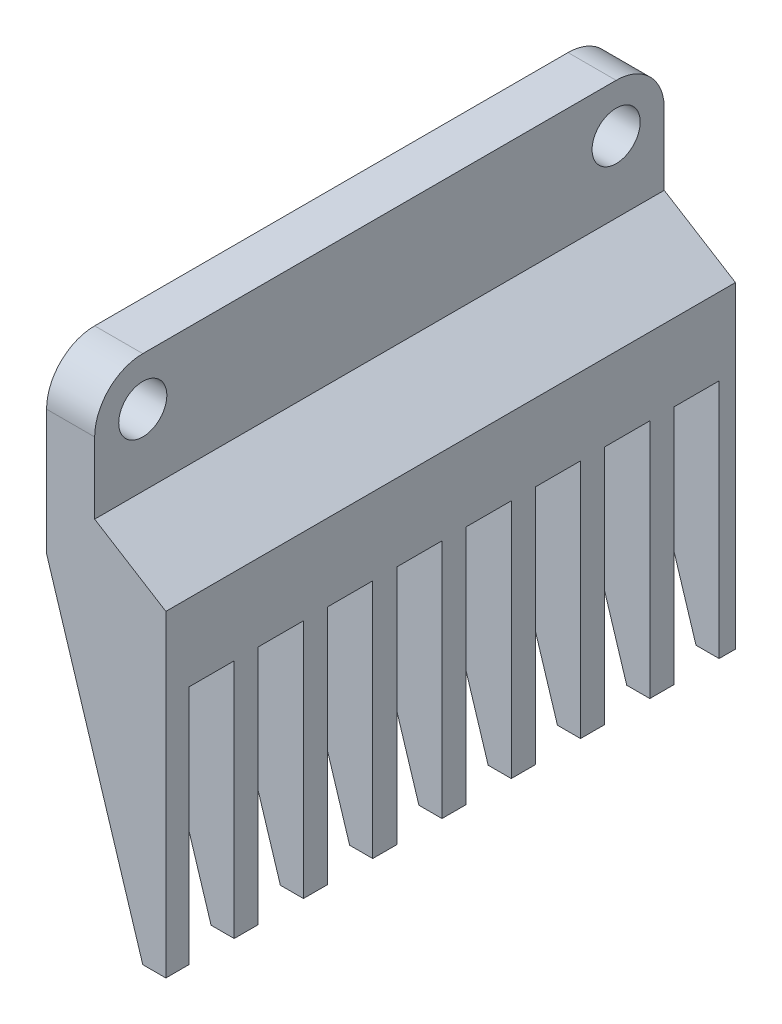
from build123d import *

# Parameters (mm, degrees)
BOSS_EXTRUDE1_DEPTH = 75.184
FILLET1_R           = 6.35
SKETCH6_R           = 3.175
CUT_EXTRUDE2_DEPTH  = 62.992
SKETCH11_W          = 5.969
SKETCH11_H          = 31.75
CUT_EXTRUDE6_DEPTH  = 100.663851822


with BuildPart() as part:
    # Sketch1 → Boss-Extrude1 (new body)
    with BuildSketch(Plane.XY):
        Polygon((0, 0), (3.048, 0), (3.048, 41.91), (-6.35, 47.752), (-6.35, 63.5), (-12.7, 63.5), (-12.7, 40.64), align=None)
    extrude(amount=BOSS_EXTRUDE1_DEPTH)

    # Fillet1
    fillet1_edges = [part.edges().sort_by_distance(p)[0] for p in [
        (-9.525, 63.5, 75.184),
        (-9.525, 63.5, 0),
    ]]
    fillet(fillet1_edges, radius=FILLET1_R)

    # Sketch6 → Cut-Extrude2 (cut, symmetric)
    with BuildSketch(Plane(origin=(-6.35, 0, 0), x_dir=(0, 0, -1), z_dir=(1, 0, 0))):
        with Locations(Location((-68.834, 57.15, 0), (0, 0, 90))):
            Circle(SKETCH6_R)
        with Locations(Location((-6.35, 57.15, 0), (0, 0, 90))):
            Circle(SKETCH6_R)
    extrude(amount=CUT_EXTRUDE2_DEPTH, both=True, mode=Mode.SUBTRACT)

    # Sketch11 → Cut-Extrude6 (cut, through all)
    with BuildSketch(Plane(origin=(3.048, 0, 0), x_dir=(0, 0, -1), z_dir=(1, 0, 0))):
        with Locations((-69.1515, 15.875)):
            Rectangle(SKETCH11_W, SKETCH11_H)
        with Locations((-60.0075, 15.875)):
            Rectangle(SKETCH11_W, SKETCH11_H)
        with Locations((-50.8635, 15.875)):
            Rectangle(SKETCH11_W, SKETCH11_H)
        with Locations((-41.7195, 15.875)):
            Rectangle(SKETCH11_W, SKETCH11_H)
        with Locations((-32.5755, 15.875)):
            Rectangle(SKETCH11_W, SKETCH11_H)
        with Locations((-23.4315, 15.875)):
            Rectangle(SKETCH11_W, SKETCH11_H)
        with Locations((-14.2875, 15.875)):
            Rectangle(SKETCH11_W, SKETCH11_H)
        with Locations((-5.1435, 15.875)):
            Rectangle(SKETCH11_W, SKETCH11_H)
    extrude(amount=-CUT_EXTRUDE6_DEPTH, mode=Mode.SUBTRACT)


solid = part.part
